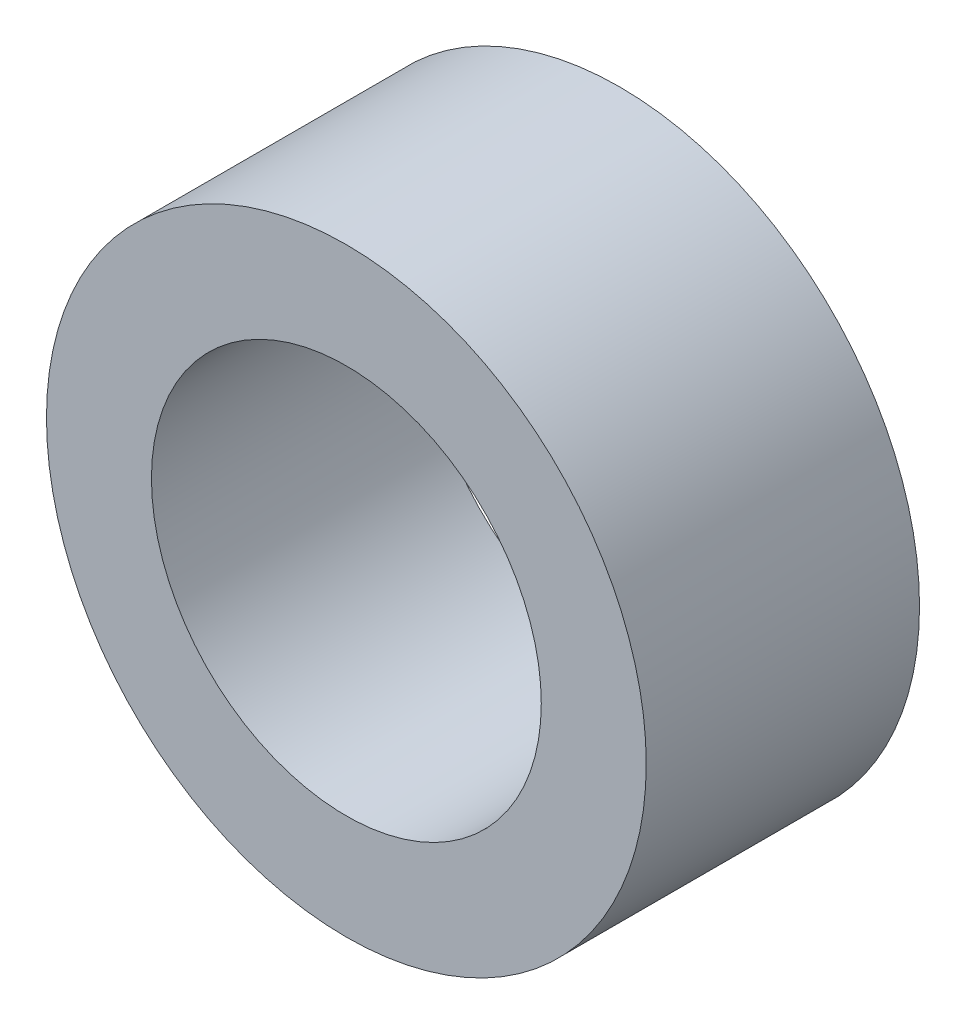
from build123d import *

# Parameters (mm, degrees)
SKETCH1_R           = 5
SKETCH1_R_2         = 3.25
BOSS_EXTRUDE1_DEPTH = 2.27825


with BuildPart() as part:
    # Sketch1 → Boss-Extrude1 (new, symmetric)
    with BuildSketch(Plane.XY):
        Circle(SKETCH1_R)
        Circle(SKETCH1_R_2, mode=Mode.SUBTRACT)
    extrude(amount=BOSS_EXTRUDE1_DEPTH, both=True)


solid = part.part
